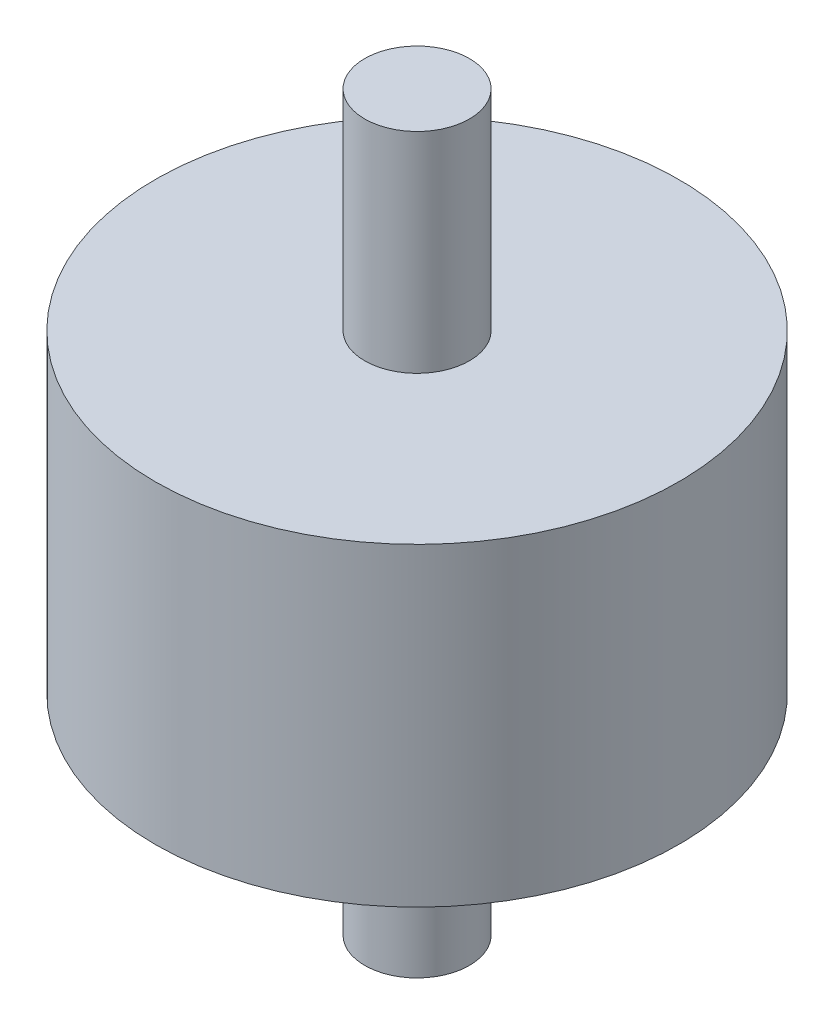
from build123d import *

# Parameters (mm, degrees)
SKETCH1_R           = 2.5
BOSS_EXTRUDE1_DEPTH = 3
SKETCH2_R           = 0.5
BOSS_EXTRUDE2_DEPTH = 2
BOSS_EXTRUDE3_START = 2
SKETCH3_R           = 0.5
BOSS_EXTRUDE3_DEPTH = 2


with BuildPart() as part:
    # Sketch1 → Boss-Extrude1 (new body)
    with BuildSketch(Plane(origin=(0, 0, 0), x_dir=(1, 0, 0), z_dir=(0, 1, 0))):
        with Locations(Location((0, 0, 0), (0, 0, 270))):
            Circle(SKETCH1_R)
    extrude(amount=BOSS_EXTRUDE1_DEPTH)

    # Sketch2 → Boss-Extrude2 (add)
    with BuildSketch(Plane(origin=(0, 3, 0), x_dir=(1, 0, 0), z_dir=(0, 1, 0))):
        with Locations(Location((0, 0, 0), (0, 0, 270))):
            Circle(SKETCH2_R)
    extrude(amount=BOSS_EXTRUDE2_DEPTH)

    # Sketch3 → Boss-Extrude3 (add)
    with BuildSketch(Plane(origin=(0, 0, 0), x_dir=(-1, 0, 0), z_dir=(0, -1, 0)).offset(BOSS_EXTRUDE3_START)):
        with Locations(Location((0, 0, 0), (0, 0, 270))):
            Circle(SKETCH3_R)
    extrude(amount=-BOSS_EXTRUDE3_DEPTH)


solid = part.part
